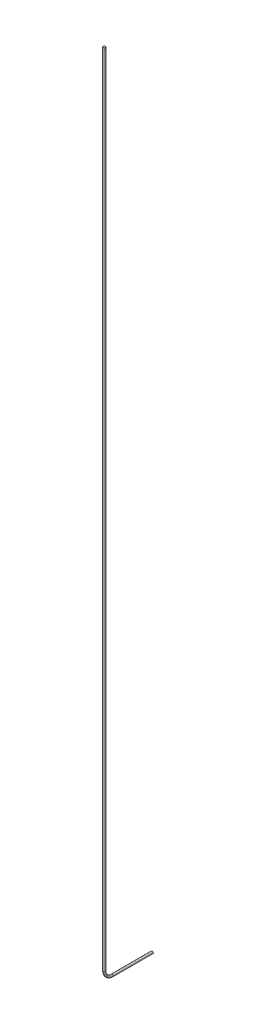
from build123d import *

# Parameters (mm, degrees)
SKETCH_1_R      = 0.7
EXTRUDE_1_DEPTH = 20
SKETCH_2_R      = 0.7


with BuildPart() as part:
    # ｽｹｯﾁ1 → ﾎﾞｽ - 押し出し1 (new body)
    with BuildSketch(Plane.XY):
        Circle(SKETCH_1_R)
    extrude(amount=EXTRUDE_1_DEPTH)

    # ｽｲｰﾌﾟ1: sweep along a path in ｽｹｯﾁ3
    with BuildLine(Plane(origin=(0, 0, 0), x_dir=(0, 0, -1), z_dir=(1, 0, 0))) as sweep_1_path:
        Line((-20, 0), (-25, 0))
        ThreePointArc((-25, 0), (-28.535533906, 1.464466094), (-30, 5))
        Line((-30, 5), (-30, 505))
    # ｽｹｯﾁ2 → ｽｲｰﾌﾟ1 (sweep)
    with BuildSketch(Plane.XY.offset(20)):
        Circle(SKETCH_2_R)
    sweep(path=sweep_1_path.line)


solid = part.part
